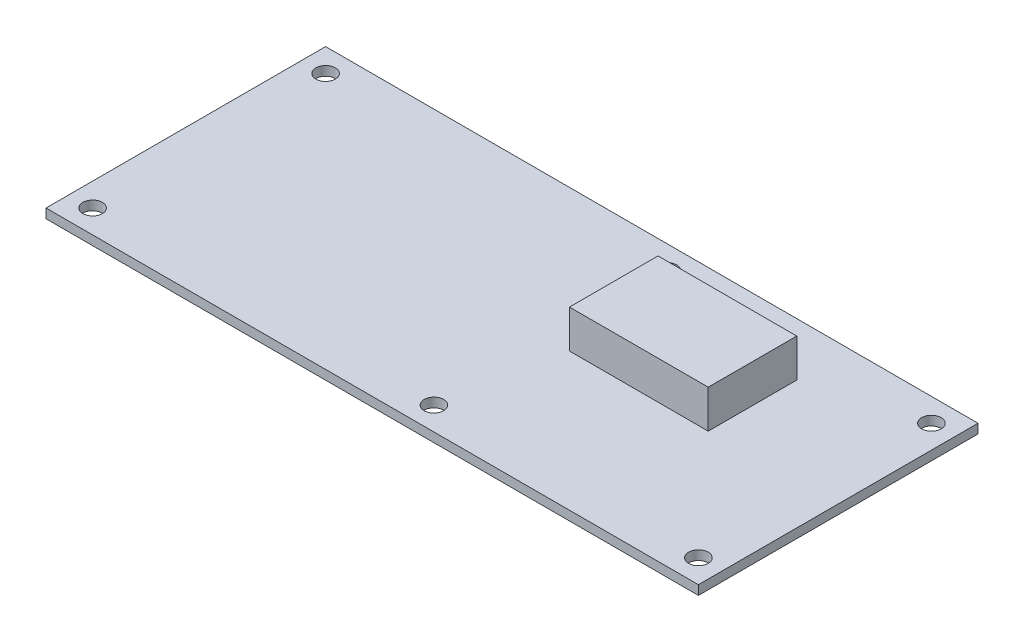
from build123d import *

# Parameters (mm, degrees)
SKETCH1_W           = 140
SKETCH1_H           = 60
SKETCH1_R           = 2.0955
BOSS_EXTRUDE1_DEPTH = 2
SKETCH2_W           = 29.777089478
SKETCH2_H           = 19.000212295
BOSS_EXTRUDE2_DEPTH = 8.174


with BuildPart() as part:
    # Sketch1 → Boss-Extrude1 (new body)
    with BuildSketch(Plane(origin=(0, 0, 0), x_dir=(1, 0, 0), z_dir=(0, 1, 0))):
        with Locations((-8.25, 0)):
            Rectangle(SKETCH1_W, SKETCH1_H)
        with Locations(Location((-73.25, 25, 0), (0, 0, 270))):
            Circle(SKETCH1_R, mode=Mode.SUBTRACT)
        with Locations(Location((-73.25, -25, 0), (0, 0, 270))):
            Circle(SKETCH1_R, mode=Mode.SUBTRACT)
        with Locations(Location((0, 25, 0), (0, 0, 270))):
            Circle(SKETCH1_R, mode=Mode.SUBTRACT)
        with Locations(Location((0, -25, 0), (0, 0, 270))):
            Circle(SKETCH1_R, mode=Mode.SUBTRACT)
        with Locations(Location((56.75, 25, 0), (0, 0, 270))):
            Circle(SKETCH1_R, mode=Mode.SUBTRACT)
        with Locations(Location((56.75, -25, 0), (0, 0, 270))):
            Circle(SKETCH1_R, mode=Mode.SUBTRACT)
    extrude(amount=BOSS_EXTRUDE1_DEPTH)

    # Sketch2 → Boss-Extrude2 (add)
    with BuildSketch(Plane(origin=(0, 2, 0), x_dir=(1, 0, 0), z_dir=(0, 1, 0))):
        with Locations((19.386769675, 9.085304713)):
            Rectangle(SKETCH2_W, SKETCH2_H)
    extrude(amount=BOSS_EXTRUDE2_DEPTH)


solid = part.part
